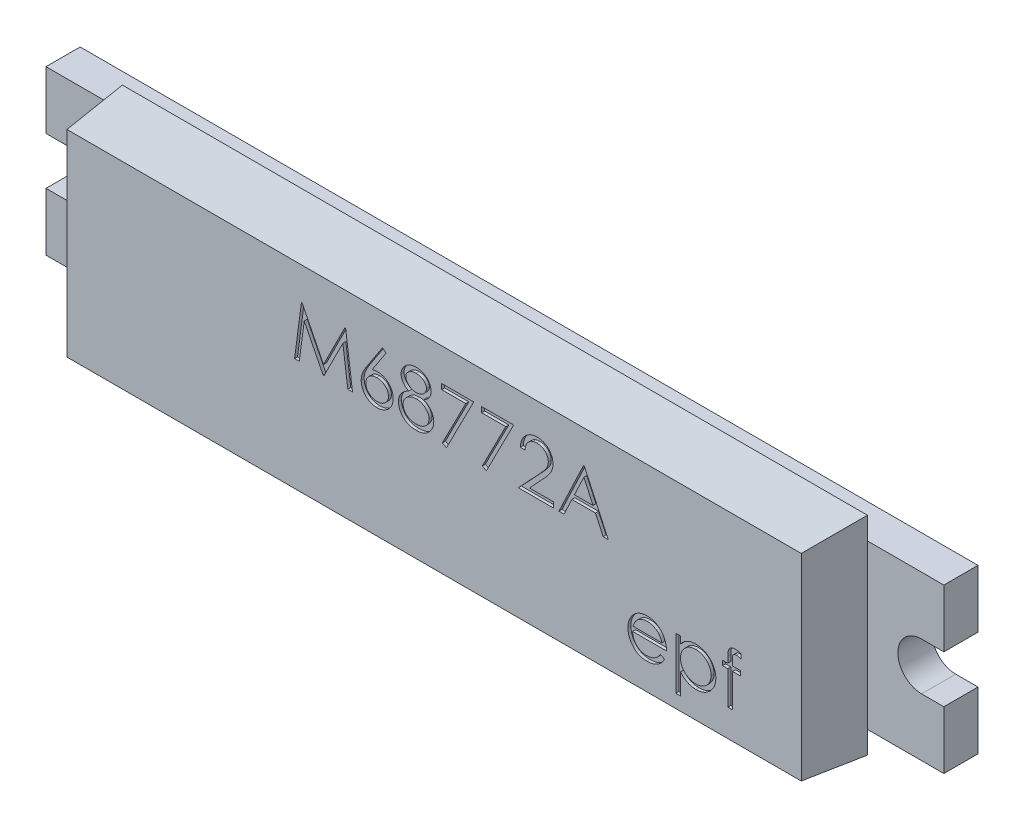
from build123d import *

# Parameters (mm, degrees)
CROQUIS1_W              = 60.5
CROQUIS1_H              = 11
SALIENTE_EXTRUIR1_DEPTH = 2.3
CORTAR_EXTRUIR1_REACH   = 32.832
CROQUIS3_W              = 50.2
CROQUIS3_H              = 14
SALIENTE_EXTRUIR2_DEPTH = 4.1
SALIENTE_EXTRUIR2_TAPER = 5
SALIENTE_EXTRUIR3_START = -8.3
SALIENTE_EXTRUIR3_DEPTH = 0.2
SALIENTE_EXTRUIR4_START = -21.3
SALIENTE_EXTRUIR4_DEPTH = 0.2
SALIENTE_EXTRUIR5_START = -43.3
SALIENTE_EXTRUIR5_DEPTH = 0.2
SALIENTE_EXTRUIR6_START = -51.3
SALIENTE_EXTRUIR6_DEPTH = 0.2
CORTAR_EXTRUIR2_DEPTH   = 0.2


with BuildPart() as part:
    # Croquis1 → Saliente-Extruir1 (new body)
    with BuildSketch(Plane.XY):
        Rectangle(CROQUIS1_W, CROQUIS1_H)
    extrude(amount=SALIENTE_EXTRUIR1_DEPTH)

    # Croquis2 → Cortar-Extruir1 (cut, up to next)
    with BuildSketch(Plane.XY.offset(2.3), mode=Mode.PRIVATE) as cortar_extruir1_sk1:
        with BuildLine():
            Line((-28.75, 1.6), (-31.56977125, 1.6))
            Line((-31.56977125, 1.6), (-31.56977125, -1.6))
            Line((-31.56977125, -1.6), (-28.75, -1.6))
            ThreePointArc((-28.75, -1.6), (-27.15, 0), (-28.75, 1.6))
        make_face()
    cortar_extruir1_tool1 = extrude(cortar_extruir1_sk1.sketch, amount=-CORTAR_EXTRUIR1_REACH, mode=Mode.PRIVATE) & part.part
    # Croquis2 → Cortar-Extruir1 (cut, up to next)
    with BuildSketch(Plane.XY.offset(2.3), mode=Mode.PRIVATE) as cortar_extruir1_sk2:
        with BuildLine():
            Line((28.75, 1.6), (32.357383151, 1.6))
            Line((32.357383151, 1.6), (32.357383151, -1.6))
            Line((32.357383151, -1.6), (28.75, -1.6))
            ThreePointArc((28.75, -1.6), (27.15, 0), (28.75, 1.6))
        make_face()
    cortar_extruir1_tool2 = extrude(cortar_extruir1_sk2.sketch, amount=-CORTAR_EXTRUIR1_REACH, mode=Mode.PRIVATE) & part.part
    add(cortar_extruir1_tool1.solids().sort_by_distance((-29.515925, 0, 2.3))[0], mode=Mode.SUBTRACT)
    add(cortar_extruir1_tool2.solids().sort_by_distance((29.912264, 0, 2.3))[0], mode=Mode.SUBTRACT)

    # Croquis3 → Saliente-Extruir2 (add)
    with BuildSketch(Plane.XY.offset(2.3)):
        Rectangle(CROQUIS3_W, CROQUIS3_H)
    extrude(amount=SALIENTE_EXTRUIR2_DEPTH, taper=SALIENTE_EXTRUIR2_TAPER)

    # Croquis6 → Saliente-Extruir3 (add)
    with BuildSketch(Plane.ZY.offset(30.25).offset(SALIENTE_EXTRUIR3_START)):
        with BuildLine():
            Line((0, -10), (0.2, -10))
            Line((0.2, -10), (0.2, -9.074823795))
            Line((0.2, -9.074823795), (3.528216632, -8.09593655))
            ThreePointArc((3.528216632, -8.09593655), (3.580067669, -8.059909669), (3.6, -8))
            Line((3.6, -8), (3.6, 0))
            Line((3.6, 0), (3.4, 0))
            Line((3.4, 0), (3.4, -7.925176205))
            Line((3.4, -7.925176205), (0.071783368, -8.90406345))
            ThreePointArc((0.071783368, -8.90406345), (0.019932331, -8.940090331), (0, -9))
            Line((0, -9), (0, -10))
        make_face()
    extrude(amount=SALIENTE_EXTRUIR3_DEPTH)

    # Croquis7 → Saliente-Extruir4 (add)
    with BuildSketch(Plane.ZY.offset(30.25).offset(SALIENTE_EXTRUIR4_START)):
        with BuildLine():
            Line((3.6, -6.886264737), (3.4, -6.90376247))
            Line((3.4, -6.90376247), (3.4, -7.925176205))
            Line((3.4, -7.925176205), (0.071783368, -8.90406345))
            ThreePointArc((0.071783368, -8.90406345), (0.019932331, -8.940090331), (0, -9))
            Line((0, -9), (0, -10))
            Line((0, -10), (0.2, -10))
            Line((0.2, -10), (0.2, -9.074823795))
            Line((0.2, -9.074823795), (3.528216632, -8.09593655))
            ThreePointArc((3.528216632, -8.09593655), (3.580067669, -8.059909669), (3.6, -8))
            Line((3.6, -8), (3.6, -6.886264737))
        make_face()
    extrude(amount=SALIENTE_EXTRUIR4_DEPTH)

    # Croquis8 → Saliente-Extruir5 (add)
    with BuildSketch(Plane.ZY.offset(30.25).offset(SALIENTE_EXTRUIR5_START)):
        with BuildLine():
            Line((3.6, -6.886264737), (3.4, -6.90376247))
            Line((3.4, -6.90376247), (3.4, -7.925176205))
            Line((3.4, -7.925176205), (0.071783368, -8.90406345))
            ThreePointArc((0.071783368, -8.90406345), (0.019932331, -8.940090331), (0, -9))
            Line((0, -9), (0, -10))
            Line((0, -10), (0.2, -10))
            Line((0.2, -10), (0.2, -9.074823795))
            Line((0.2, -9.074823795), (3.528216632, -8.09593655))
            ThreePointArc((3.528216632, -8.09593655), (3.580067669, -8.059909669), (3.6, -8))
            Line((3.6, -8), (3.6, -6.886264737))
        make_face()
    extrude(amount=SALIENTE_EXTRUIR5_DEPTH)

    # Croquis10 → Cortar-Extruir2 (cut)
    # profile 1 of 10: a face of its own
    with BuildSketch(Plane.XY.offset(6.4)):
        Polygon((-9.400373878, 0.94396844), (-8.938334615, 4.44396844), (-8.89346282, 4.44396844), (-7.448450801, 1.572173569), (-6.00694439, 4.44396844), (-5.961371474, 4.44396844), (-5.496527724, 0.94396844), (-5.812032531, 0.94396844), (-6.147168749, 3.462397928), (-7.410590224, 0.94396844), (-7.481403525, 0.94396844), (-8.749732852, 3.468006902), (-9.084167948, 0.94396844), align=None)
    # profile 2 of 10: a face of its own
    with BuildSketch(Plane.XY.offset(6.4)):
        with BuildLine():
            Line((-3.477296955, 4.53371203), (-3.235409935, 4.343708024))
            Line((-3.235409935, 4.343708024), (-4.160189583, 2.929545364))
            add(Edge.make_bspline(
                [(-4.160189583, 2.929545364), (-4.098619306, 2.939359224), (-3.978519519, 2.958502269), (-3.85695362, 2.961660214), (-3.797709615, 2.96319921)],
                knots=[0, 0, 0, 0, 1.025318673, 2, 2, 2, 2], degree=3))
            add(Edge.make_bspline(
                [(-3.797709615, 2.96319921), (-3.762137118, 2.962243098), (-3.692113718, 2.960361021), (-3.589306916, 2.94587717), (-3.49051798, 2.923052058), (-3.396156368, 2.889779802), (-3.305883386, 2.847277448), (-3.21918099, 2.796338577), (-3.137678979, 2.734332897), (-3.0603278, 2.665067941), (-2.990100703, 2.588350957), (-2.927924647, 2.50694962), (-2.875697856, 2.420948739), (-2.833323934, 2.330391873), (-2.800419055, 2.235418614), (-2.77643141, 2.136150474), (-2.762251818, 2.032519003), (-2.760326327, 1.962040827), (-2.759348237, 1.926240075)],
                knots=[0, 0, 0, 0, 1.04369286, 2.054478336, 3.041073146, 4.015093852, 4.984733326, 5.965804835, 6.960378782, 7.985147595, 9.009457201, 10.008161701, 10.986880575, 11.956520048, 12.937015923, 13.931873656, 14.949455224, 16, 16, 16, 16], degree=3))
            add(Edge.make_bspline(
                [(-2.759348237, 1.926240075), (-2.760771341, 1.877260371), (-2.763571675, 1.780879905), (-2.791475471, 1.640503199), (-2.834835116, 1.506770683), (-2.896812644, 1.381817512), (-2.973795027, 1.265814942), (-3.06767262, 1.163029477), (-3.175116108, 1.07135944), (-3.296602906, 0.99470282), (-3.427345871, 0.932099769), (-3.564697868, 0.887134527), (-3.707325014, 0.859451058), (-3.804129622, 0.855980455), (-3.853098237, 0.854224851)],
                knots=[0, 0, 0, 0, 1.031375318, 2.029502543, 3.004789286, 3.987476834, 4.960371455, 5.9300674, 6.912260825, 7.929083631, 8.949397511, 9.960523116, 10.96833055, 12, 12, 12, 12], degree=3))
            add(Edge.make_bspline(
                [(-3.853098237, 0.854224851), (-3.900194937, 0.855753056), (-3.993485255, 0.858780165), (-4.130718049, 0.885746102), (-4.262581067, 0.929453205), (-4.388150448, 0.989667484), (-4.504471061, 1.065725367), (-4.608536697, 1.157287646), (-4.699828472, 1.262397111), (-4.775803093, 1.381037458), (-4.836061825, 1.508527416), (-4.88125175, 1.641464572), (-4.907647993, 1.779364554), (-4.91133655, 1.872845693), (-4.91319439, 1.919929979)],
                knots=[0, 0, 0, 0, 1.012016664, 2.004627821, 2.994792927, 3.992885782, 4.990978636, 5.973936114, 6.964471063, 7.975201453, 8.993600317, 9.990122807, 10.98767138, 12, 12, 12, 12], degree=3))
            add(Edge.make_bspline(
                [(-4.91319439, 1.919929979), (-4.912012945, 1.955974562), (-4.90960066, 2.029570714), (-4.89275727, 2.141034742), (-4.865692475, 2.255085824), (-4.835382229, 2.351840017), (-4.803356619, 2.431101539), (-4.776704079, 2.49500503), (-4.743530083, 2.560766103), (-4.708156702, 2.630639739), (-4.667399833, 2.702825172), (-4.623084184, 2.778528841), (-4.573984533, 2.856546769), (-4.53956437, 2.909490964), (-4.521968429, 2.936556582)],
                knots=[0, 0, 0, 0, 1.173818275, 2.396712641, 3.66331629, 4.989737886, 5.693666774, 6.447286557, 7.243889047, 8.091586357, 8.998013824, 9.943181721, 10.948533338, 12, 12, 12, 12], degree=3))
            Line((-4.521968429, 2.936556582), (-3.477296955, 4.53371203))
        make_face()
        with BuildLine():
            add(Edge.make_bspline(
                [(-3.863615063, 2.604224851), (-3.890277308, 2.603446807), (-3.942356418, 2.601927062), (-4.018763832, 2.59310181), (-4.091077084, 2.576482744), (-4.160254218, 2.555316412), (-4.22500192, 2.526213353), (-4.28579076, 2.490861554), (-4.342855812, 2.449240375), (-4.395599364, 2.401939464), (-4.443419027, 2.350151431), (-4.484600158, 2.294681909), (-4.520122558, 2.236867706), (-4.549004377, 2.176225764), (-4.571494453, 2.112779264), (-4.587762704, 2.046820015), (-4.596816455, 1.977905709), (-4.598322686, 1.931173206), (-4.599091826, 1.907309787)],
                knots=[0, 0, 0, 0, 1.129588631, 2.206414736, 3.251139165, 4.268635594, 5.265702196, 6.250456724, 7.242448911, 8.251968645, 9.246821453, 10.222880186, 11.173611482, 12.116736599, 13.062300278, 14.020270554, 14.989073742, 16, 16, 16, 16], degree=3))
            add(Edge.make_bspline(
                [(-4.599091826, 1.907309787), (-4.598465465, 1.883659807), (-4.597237263, 1.837285717), (-4.586084943, 1.768946537), (-4.569049861, 1.703181629), (-4.543709465, 1.64033003), (-4.513482577, 1.579433712), (-4.473577253, 1.522698427), (-4.429360467, 1.466678357), (-4.376506534, 1.415676885), (-4.319783171, 1.368220261), (-4.259181968, 1.326740008), (-4.196022008, 1.291253834), (-4.129450586, 1.263442737), (-4.060412202, 1.24061845), (-3.988331648, 1.22455697), (-3.913158793, 1.215476444), (-3.862236855, 1.213968251), (-3.836271313, 1.21319921)],
                knots=[0, 0, 0, 0, 0.989467248, 1.94019797, 2.891935182, 3.827694429, 4.772920941, 5.730924762, 6.725747692, 7.756678648, 8.79901574, 9.819492441, 10.826891316, 11.826466727, 12.835195252, 13.867842842, 14.912794438, 16, 16, 16, 16], degree=3))
            add(Edge.make_bspline(
                [(-3.836271313, 1.21319921), (-3.810305815, 1.213968311), (-3.75938396, 1.215476623), (-3.6842105, 1.224556292), (-3.612132182, 1.24062094), (-3.543085673, 1.26343371), (-3.476544242, 1.29128732), (-3.41343952, 1.326519239), (-3.353411427, 1.368475357), (-3.296650827, 1.415595785), (-3.244016889, 1.466968637), (-3.19873961, 1.52219836), (-3.160056377, 1.579892255), (-3.12862219, 1.640090145), (-3.103560898, 1.703219633), (-3.086439431, 1.768936356), (-3.075310142, 1.837288382), (-3.074078776, 1.883660707), (-3.073450801, 1.907309787)],
                knots=[0, 0, 0, 0, 1.087397944, 2.132534446, 3.165364764, 4.174271784, 5.174024072, 6.181601208, 7.194203697, 8.236725232, 9.267838612, 10.269026844, 11.221737037, 12.171628256, 13.107553087, 14.05945871, 15.010357665, 16, 16, 16, 16], degree=3))
            add(Edge.make_bspline(
                [(-3.073450801, 1.907309787), (-3.074001094, 1.931204338), (-3.07508114, 1.97810157), (-3.087297088, 2.046789188), (-3.104239462, 2.113114395), (-3.129822493, 2.176660344), (-3.163059038, 2.237176271), (-3.203542445, 2.294967872), (-3.250375015, 2.350478219), (-3.304472555, 2.402041027), (-3.363362789, 2.449188105), (-3.425978374, 2.490807662), (-3.491486348, 2.525932638), (-3.55982029, 2.555239741), (-3.631763173, 2.576389215), (-3.706153512, 2.593042458), (-3.783942755, 2.601904476), (-3.836719363, 2.603441541), (-3.863615063, 2.604224851)],
                knots=[0, 0, 0, 0, 0.978206639, 1.919901502, 2.851605144, 3.780102724, 4.718870031, 5.675451981, 6.667674623, 7.690630536, 8.733308323, 9.756129687, 10.767539656, 11.776269907, 12.797430371, 13.836405707, 14.897401972, 16, 16, 16, 16], degree=3))
        make_face(mode=Mode.SUBTRACT)
    # profile 3 of 10: a face of its own
    with BuildSketch(Plane.XY.offset(6.4)):
        with BuildLine():
            add(Edge.make_bspline(
                [(-0.698751281, 2.893788152), (-0.670102734, 2.878850196), (-0.6142285, 2.849716193), (-0.534651291, 2.802805365), (-0.46192629, 2.753364401), (-0.394035728, 2.703728541), (-0.332172378, 2.65199689), (-0.277027965, 2.597963734), (-0.227240345, 2.542977788), (-0.183813561, 2.486107948), (-0.145616724, 2.427505299), (-0.112604589, 2.367016026), (-0.084387386, 2.304772692), (-0.062024447, 2.240095862), (-0.043602656, 2.173935601), (-0.030927051, 2.105437619), (-0.024110133, 2.035053278), (-0.022821319, 1.987484976), (-0.022168749, 1.96339953)],
                knots=[0, 0, 0, 0, 1.272397273, 2.481599622, 3.635517121, 4.734568067, 5.792894095, 6.808321871, 7.773003508, 8.711915296, 9.623354172, 10.525449501, 11.423591555, 12.311487226, 13.218079475, 14.126165749, 15.051214107, 16, 16, 16, 16], degree=3))
            add(Edge.make_bspline(
                [(-0.022168749, 1.96339953), (-0.02294017, 1.929701798), (-0.024467101, 1.863001341), (-0.037767085, 1.764555229), (-0.057680063, 1.668943447), (-0.086759575, 1.576186957), (-0.124472966, 1.486797583), (-0.170949802, 1.40069881), (-0.223561007, 1.316479501), (-0.265813247, 1.264660099), (-0.287192788, 1.238439594)],
                knots=[0, 0, 0, 0, 1.025265484, 2.029385089, 3.018602448, 3.995076438, 4.983346944, 5.966715145, 6.97116228, 8, 8, 8, 8], degree=3))
            add(Edge.make_bspline(
                [(-0.287192788, 1.238439594), (-0.315029262, 1.20784582), (-0.370358228, 1.147036328), (-0.465141155, 1.068085518), (-0.569163039, 1.001736123), (-0.682021372, 0.947664229), (-0.803414473, 0.90557837), (-0.933316478, 0.875335852), (-1.071980631, 0.858013423), (-1.167286102, 0.855509433), (-1.216179166, 0.854224851)],
                knots=[0, 0, 0, 0, 0.954267603, 1.896743057, 2.838368354, 3.796610408, 4.779680527, 5.799409237, 6.871065594, 8, 8, 8, 8], degree=3))
            add(Edge.make_bspline(
                [(-1.216179166, 0.854224851), (-1.263192555, 0.855377329), (-1.354675834, 0.857619934), (-1.487833711, 0.872814365), (-1.611956781, 0.899442232), (-1.727766749, 0.935886841), (-1.834565443, 0.98329707), (-1.932048544, 1.042305478), (-2.021622516, 1.110536921), (-2.10056899, 1.189950999), (-2.170657434, 1.275008871), (-2.232225487, 1.362760481), (-2.283399565, 1.453213838), (-2.32672666, 1.545020206), (-2.359894683, 1.63946636), (-2.382866893, 1.736066373), (-2.397456208, 1.834651516), (-2.399397342, 1.901183169), (-2.400373878, 1.934653537)],
                knots=[0, 0, 0, 0, 1.256902934, 2.445805442, 3.576955095, 4.645999104, 5.686449165, 6.692658513, 7.68621702, 8.689161843, 9.678783111, 10.630372946, 11.551080876, 12.453998257, 13.34127905, 14.221779781, 15.105423033, 16, 16, 16, 16], degree=3))
            add(Edge.make_bspline(
                [(-2.400373878, 1.934653537), (-2.399795997, 1.959212729), (-2.3986539, 2.007750361), (-2.390749051, 2.079459689), (-2.37804059, 2.149255824), (-2.360781133, 2.217396567), (-2.337390107, 2.28338584), (-2.309147974, 2.347536314), (-2.276216021, 2.409920412), (-2.238134856, 2.470879294), (-2.193832832, 2.529558806), (-2.143669182, 2.5869548), (-2.086641314, 2.642176667), (-2.023383655, 2.695899092), (-1.954619115, 2.749075066), (-1.878561585, 2.798830795), (-1.797227317, 2.84868876), (-1.739421912, 2.878497085), (-1.70976891, 2.893788152)],
                knots=[0, 0, 0, 0, 0.941657376, 1.861047343, 2.762797495, 3.66048619, 4.553285746, 5.444104102, 6.34607688, 7.256116206, 8.197091036, 9.162375105, 10.176350973, 11.237807142, 12.343728897, 13.50695164, 14.721116704, 16, 16, 16, 16], degree=3))
            add(Edge.make_bspline(
                [(-1.70976891, 2.893788152), (-1.750360284, 2.915922921), (-1.828956547, 2.958782028), (-1.933025988, 3.037528834), (-2.022416612, 3.122816649), (-2.094671329, 3.216446444), (-2.151543557, 3.315493318), (-2.190562162, 3.419337571), (-2.216958646, 3.526053684), (-2.219573473, 3.598959881), (-2.220886698, 3.635575011)],
                knots=[0, 0, 0, 0, 1.166880483, 2.259407225, 3.286803203, 4.280235371, 5.237608625, 6.161067461, 7.076446754, 8, 8, 8, 8], degree=3))
            add(Edge.make_bspline(
                [(-2.220886698, 3.635575011), (-2.219251274, 3.672872569), (-2.215963786, 3.747847166), (-2.189380466, 3.85945329), (-2.146060399, 3.969069855), (-2.087139402, 4.076165567), (-2.013752186, 4.177115782), (-1.92570564, 4.267656728), (-1.825102343, 4.346968211), (-1.712444476, 4.413544384), (-1.591208241, 4.467728042), (-1.463292517, 4.505106465), (-1.330926024, 4.529542582), (-1.240828304, 4.532309237), (-1.195145512, 4.53371203)],
                knots=[0, 0, 0, 0, 0.888701115, 1.786444228, 2.72001202, 3.692817113, 4.693886446, 5.687152267, 6.695133018, 7.739871481, 8.800368666, 9.853104506, 10.91144658, 12, 12, 12, 12], degree=3))
            add(Edge.make_bspline(
                [(-1.195145512, 4.53371203), (-1.150641697, 4.532265687), (-1.062885244, 4.529413663), (-0.933890616, 4.505626785), (-0.810465739, 4.465897265), (-0.69303624, 4.412000042), (-0.583704373, 4.345613101), (-0.487102063, 4.265212227), (-0.401769481, 4.175070677), (-0.331185087, 4.074151073), (-0.273022198, 3.96746688), (-0.232521297, 3.855844359), (-0.206569323, 3.7416953), (-0.203295958, 3.664457296), (-0.201655929, 3.625759306)],
                knots=[0, 0, 0, 0, 1.072916533, 2.115669174, 3.151510826, 4.193348718, 5.225979165, 6.227137561, 7.216255879, 8.211077061, 9.189680878, 10.138522389, 11.067357538, 12, 12, 12, 12], degree=3))
            add(Edge.make_bspline(
                [(-0.201655929, 3.625759306), (-0.20309049, 3.587782642), (-0.205907885, 3.513198633), (-0.229607825, 3.404472112), (-0.269521138, 3.302650073), (-0.324015301, 3.206577121), (-0.395040789, 3.117995623), (-0.481649522, 3.035779154), (-0.583151, 2.959252325), (-0.659411886, 2.916065961), (-0.698751281, 2.893788152)],
                knots=[0, 0, 0, 0, 0.975232327, 1.915300861, 2.843280834, 3.77672583, 4.742871857, 5.749627742, 6.839139064, 8, 8, 8, 8], degree=3))
        make_face()
        with BuildLine():
            add(Edge.make_bspline(
                [(-1.212673557, 4.174737671), (-1.237224363, 4.174086231), (-1.285256474, 4.172811728), (-1.355685145, 4.166153091), (-1.422657513, 4.153199874), (-1.486873313, 4.135961163), (-1.547452125, 4.112673175), (-1.60521668, 4.085278165), (-1.65918387, 4.0519721), (-1.710005173, 4.014610902), (-1.755755947, 3.973517996), (-1.796360499, 3.930704277), (-1.830088613, 3.885328885), (-1.858729723, 3.838520525), (-1.87951124, 3.788889949), (-1.895075544, 3.737958773), (-1.905596935, 3.685083389), (-1.906385325, 3.648946878), (-1.906784134, 3.630667158)],
                knots=[0, 0, 0, 0, 1.203892937, 2.355340988, 3.463153438, 4.544400666, 5.610487187, 6.640501085, 7.674077295, 8.714426146, 9.728707835, 10.68524104, 11.601827946, 12.495867327, 13.368432065, 14.231010473, 15.105153427, 16, 16, 16, 16], degree=3))
            add(Edge.make_bspline(
                [(-1.906784134, 3.630667158), (-1.906096767, 3.612386649), (-1.904738431, 3.576261736), (-1.894233303, 3.52291587), (-1.878576449, 3.470494233), (-1.853925787, 3.420243322), (-1.824359429, 3.370419963), (-1.787867953, 3.322269377), (-1.744378925, 3.275623992), (-1.695351485, 3.230880551), (-1.641939947, 3.188981788), (-1.585355903, 3.152608606), (-1.526309512, 3.122174496), (-1.465407443, 3.096845091), (-1.402028995, 3.077155154), (-1.336562522, 3.063186507), (-1.26899702, 3.05450451), (-1.223216439, 3.053467489), (-1.200053365, 3.052942799)],
                knots=[0, 0, 0, 0, 0.873023192, 1.725219244, 2.590779336, 3.480155217, 4.391973325, 5.357036234, 6.360879153, 7.436073238, 8.526419356, 9.601555421, 10.645666583, 11.697338044, 12.750135903, 13.812665442, 14.89329948, 16, 16, 16, 16], degree=3))
            add(Edge.make_bspline(
                [(-1.200053365, 3.052942799), (-1.170303261, 3.053815667), (-1.111096893, 3.05555278), (-1.023817562, 3.071703953), (-0.938954917, 3.097109871), (-0.857416013, 3.131869837), (-0.781311428, 3.175497697), (-0.713471359, 3.227730715), (-0.654474467, 3.287362813), (-0.604933856, 3.353465648), (-0.56652401, 3.423817237), (-0.536622202, 3.494417529), (-0.519160987, 3.56601976), (-0.51688342, 3.613986724), (-0.515758493, 3.637678376)],
                knots=[0, 0, 0, 0, 1.076279235, 2.141928126, 3.20205304, 4.278698113, 5.344010996, 6.36967002, 7.368914609, 8.37248503, 9.349703398, 10.264243087, 11.142681841, 12, 12, 12, 12], degree=3))
            add(Edge.make_bspline(
                [(-0.515758493, 3.637678376), (-0.516290391, 3.654306412), (-0.517346131, 3.68731068), (-0.526046187, 3.736049046), (-0.54042202, 3.783678629), (-0.5598851, 3.8305929), (-0.585494895, 3.876133632), (-0.615859082, 3.92101672), (-0.652743584, 3.964232484), (-0.694140017, 4.006788032), (-0.741085426, 4.046172056), (-0.793489338, 4.080806766), (-0.851083088, 4.110219123), (-0.913868038, 4.134107877), (-0.981612962, 4.152050227), (-1.054005837, 4.165486575), (-1.131650284, 4.173059686), (-1.185080035, 4.174166212), (-1.212673557, 4.174737671)],
                knots=[0, 0, 0, 0, 0.814439003, 1.616544685, 2.417341072, 3.248991801, 4.09997495, 4.973547432, 5.9003056, 6.880240646, 7.880314356, 8.896779544, 9.951930927, 11.043077905, 12.18215768, 13.381699519, 14.647792085, 16, 16, 16, 16], degree=3))
        make_face(mode=Mode.SUBTRACT)
        with BuildLine():
            add(Edge.make_bspline(
                [(-1.192341025, 2.69396844), (-1.223466811, 2.693414799), (-1.284528007, 2.69232869), (-1.373984935, 2.680239189), (-1.459838101, 2.663409796), (-1.541798037, 2.637878958), (-1.619830134, 2.604682468), (-1.694356817, 2.564747928), (-1.764807946, 2.517542484), (-1.830210672, 2.463665869), (-1.889934002, 2.405606415), (-1.942332302, 2.34414428), (-1.986829822, 2.280421747), (-2.022663073, 2.213629518), (-2.052074805, 2.145181907), (-2.071388683, 2.073374312), (-2.083770394, 1.999587198), (-2.085433026, 1.9494271), (-2.086271313, 1.92413671)],
                knots=[0, 0, 0, 0, 1.140299081, 2.23698856, 3.303958914, 4.344563908, 5.37730929, 6.408454204, 7.439741482, 8.480804886, 9.510774543, 10.48932336, 11.43758569, 12.353841022, 13.263987381, 14.161954604, 15.073269652, 16, 16, 16, 16], degree=3))
            add(Edge.make_bspline(
                [(-2.086271313, 1.92413671), (-2.084908055, 1.892705804), (-2.082203381, 1.83034762), (-2.060746742, 1.738184549), (-2.026311207, 1.648963494), (-1.978285991, 1.563411541), (-1.918818418, 1.483461435), (-1.84569195, 1.413772659), (-1.763451113, 1.351851181), (-1.669313259, 1.301770647), (-1.566484793, 1.261775792), (-1.454993064, 1.23421983), (-1.336438145, 1.21597838), (-1.254578553, 1.214140199), (-1.212673557, 1.21319921)],
                knots=[0, 0, 0, 0, 0.898778495, 1.783155532, 2.693654817, 3.627872908, 4.583023416, 5.533784346, 6.509005473, 7.520592997, 8.575161974, 9.658835044, 10.801527049, 12, 12, 12, 12], degree=3))
            add(Edge.make_bspline(
                [(-1.212673557, 1.21319921), (-1.179923189, 1.213828018), (-1.11611497, 1.215053139), (-1.023029021, 1.225867433), (-0.935184473, 1.243017058), (-0.852751674, 1.267960603), (-0.774807834, 1.29841058), (-0.70267448, 1.337582661), (-0.634495953, 1.382134985), (-0.573631831, 1.434993141), (-0.518198622, 1.491472636), (-0.469865329, 1.551262679), (-0.427907778, 1.612738311), (-0.394976822, 1.677288796), (-0.368650569, 1.74367571), (-0.349727014, 1.812511222), (-0.338050799, 1.884006455), (-0.336869903, 1.932505526), (-0.336271313, 1.957089434)],
                knots=[0, 0, 0, 0, 1.224942928, 2.386581632, 3.501229538, 4.569074225, 5.605009692, 6.626002462, 7.634866581, 8.645888296, 9.63523824, 10.59253846, 11.518950513, 12.414518923, 13.29783783, 14.186679152, 15.080837789, 16, 16, 16, 16], degree=3))
            add(Edge.make_bspline(
                [(-0.336271313, 1.957089434), (-0.337177162, 1.980966775), (-0.338963337, 2.028048719), (-0.350300028, 2.097815246), (-0.370215906, 2.16521806), (-0.397543302, 2.231068066), (-0.433924265, 2.294031017), (-0.476769135, 2.355747188), (-0.528463254, 2.414503633), (-0.58687585, 2.470756729), (-0.650534811, 2.522772466), (-0.718201955, 2.568786904), (-0.789356418, 2.60753902), (-0.863847628, 2.639055516), (-0.941510184, 2.663842985), (-1.022286963, 2.681158981), (-1.106272538, 2.692058583), (-1.163327408, 2.693324629), (-1.192341025, 2.69396844)],
                knots=[0, 0, 0, 0, 0.917430815, 1.809013306, 2.70690318, 3.612392954, 4.541220862, 5.495268465, 6.494511384, 7.542276156, 8.608045339, 9.649016899, 10.681629292, 11.715607085, 12.752076957, 13.808767841, 14.885711793, 16, 16, 16, 16], degree=3))
        make_face(mode=Mode.SUBTRACT)
    # profile 4 of 10: a face of its own
    with BuildSketch(Plane.XY.offset(6.4)):
        Polygon((0.516292789, 4.44396844), (2.670138943, 4.44396844), (0.830395353, 0.854224851), (0.559061219, 1.003563793), (2.138688622, 4.084994082), (0.516292789, 4.084994082), align=None)
    # profile 5 of 10: a face of its own
    with BuildSketch(Plane.XY.offset(6.4)):
        Polygon((3.208600481, 4.44396844), (5.362446635, 4.44396844), (3.522703045, 0.854224851), (3.251368911, 1.003563793), (4.830996315, 4.084994082), (3.208600481, 4.084994082), align=None)
    # profile 6 of 10: a face of its own
    with BuildSketch(Plane.XY.offset(6.4)):
        with BuildLine():
            Line((6.125267148, 3.367045364), (5.811164584, 3.367045364))
            add(Edge.make_bspline(
                [(5.811164584, 3.367045364), (5.813211737, 3.408716251), (5.817232291, 3.490556766), (5.83606058, 3.609880672), (5.863001457, 3.723935471), (5.901092911, 3.831805385), (5.948399189, 3.934444192), (6.005129217, 4.031444208), (6.072323067, 4.122435397), (6.148529801, 4.20657424), (6.23129844, 4.283761811), (6.32060438, 4.350417054), (6.414449407, 4.406734725), (6.512548806, 4.453815967), (6.61600937, 4.489155813), (6.723892227, 4.515377452), (6.836671364, 4.531153798), (6.913511386, 4.532849584), (6.952590866, 4.53371203)],
                knots=[0, 0, 0, 0, 1.10065271, 2.161652631, 3.183658789, 4.190468796, 5.17591951, 6.163126047, 7.15150782, 8.156236427, 9.156009102, 10.134482811, 11.092018607, 12.041330605, 13.001268258, 13.972401359, 14.968799086, 16, 16, 16, 16], degree=3))
            add(Edge.make_bspline(
                [(6.952590866, 4.53371203), (6.99096894, 4.532813574), (7.066380485, 4.531048139), (7.176442499, 4.51588711), (7.281219794, 4.492141518), (7.38050756, 4.458826102), (7.473513625, 4.414041674), (7.560936669, 4.360244136), (7.64381748, 4.298024304), (7.718424264, 4.224770491), (7.786932343, 4.146568106), (7.846034598, 4.063080203), (7.896647762, 3.976850917), (7.938835441, 3.887222716), (7.96989158, 3.793351687), (7.993469788, 3.696604484), (8.006797202, 3.595979673), (8.008842626, 3.527873118), (8.009882533, 3.493247287)],
                knots=[0, 0, 0, 0, 1.111607364, 2.184268762, 3.212621178, 4.221274766, 5.211760367, 6.196651075, 7.1921475, 8.207485113, 9.220403448, 10.201281604, 11.166441695, 12.114753415, 13.065576456, 14.026450734, 14.996634279, 16, 16, 16, 16], degree=3))
            add(Edge.make_bspline(
                [(8.009882533, 3.493247287), (8.00818927, 3.444499452), (8.004832458, 3.347859238), (7.976118082, 3.205844376), (7.931271571, 3.068250957), (7.877274214, 2.957513654), (7.82280177, 2.868280161), (7.773714262, 2.794811456), (7.716249451, 2.715705987), (7.649570953, 2.63122865), (7.575058081, 2.540717745), (7.492035918, 2.44422795), (7.399912436, 2.34275618), (7.335253935, 2.273450578), (7.30174952, 2.237538152)],
                knots=[0, 0, 0, 0, 1.184426356, 2.348067706, 3.509069118, 4.696110526, 5.333549288, 6.050745305, 6.844228056, 7.710549037, 8.667450064, 9.695053472, 10.805634456, 12, 12, 12, 12], degree=3))
            Line((7.30174952, 2.237538152), (6.426048398, 1.302942799))
            Line((6.426048398, 1.302942799), (8.054754328, 1.302942799))
            Line((8.054754328, 1.302942799), (8.054754328, 0.94396844))
            Line((8.054754328, 0.94396844), (5.676549199, 0.94396844))
            Line((5.676549199, 0.94396844), (7.033920994, 2.392486069))
            add(Edge.make_bspline(
                [(7.033920994, 2.392486069), (7.066968881, 2.426984375), (7.130447108, 2.493248562), (7.220229685, 2.589991522), (7.300868673, 2.679741063), (7.372886066, 2.762327611), (7.434719571, 2.838959179), (7.489591803, 2.907153883), (7.533557394, 2.969908333), (7.58127279, 3.042648947), (7.627486771, 3.131461264), (7.667199127, 3.239994953), (7.691413976, 3.351722206), (7.694318811, 3.427224243), (7.695779969, 3.465202415)],
                knots=[0, 0, 0, 0, 1.329631726, 2.553950428, 3.673215718, 4.687767853, 5.603093632, 6.413772471, 7.123043292, 7.734684054, 8.834405432, 9.900288307, 10.943827018, 12, 12, 12, 12], degree=3))
            add(Edge.make_bspline(
                [(7.695779969, 3.465202415), (7.695144226, 3.489083813), (7.6938913, 3.536149464), (7.682833603, 3.605155223), (7.666123097, 3.671720036), (7.642177839, 3.736048656), (7.610571099, 3.797494308), (7.572097719, 3.856131788), (7.527707655, 3.912820753), (7.476356386, 3.965974051), (7.419944866, 4.014655257), (7.360350616, 4.057779342), (7.297300512, 4.093818453), (7.23106039, 4.12336195), (7.161814921, 4.146537331), (7.089430176, 4.162595911), (7.014106159, 4.172678395), (6.962672664, 4.174042566), (6.936465065, 4.174737671)],
                knots=[0, 0, 0, 0, 0.991446411, 1.95395049, 2.89581595, 3.838931463, 4.798493298, 5.75982156, 6.748411868, 7.785213223, 8.824556874, 9.840280684, 10.836137867, 11.835679398, 12.848801643, 13.863922112, 14.911575587, 16, 16, 16, 16], degree=3))
            add(Edge.make_bspline(
                [(6.936465065, 4.174737671), (6.909094232, 4.174022639), (6.855342436, 4.172618434), (6.776423403, 4.16279577), (6.701137625, 4.145849929), (6.629295722, 4.122673255), (6.560776137, 4.093214706), (6.495912092, 4.056522961), (6.434849203, 4.012739468), (6.37747268, 3.963098912), (6.324608701, 3.907831311), (6.278161825, 3.846221348), (6.237577811, 3.779393932), (6.202168577, 3.707529382), (6.173412887, 3.629975602), (6.151439737, 3.547007897), (6.13405289, 3.458986515), (6.128244369, 3.398201431), (6.125267148, 3.367045364)],
                knots=[0, 0, 0, 0, 1.031018746, 2.02475058, 2.990194455, 3.934040569, 4.864654155, 5.795059489, 6.735614925, 7.690564532, 8.649604399, 9.611025574, 10.590972636, 11.591080095, 12.624614302, 13.701020113, 14.821632451, 16, 16, 16, 16], degree=3))
        make_face()
    # profile 7 of 10: a face of its own
    with BuildSketch(Plane.XY.offset(6.4)):
        Polygon((10.118856892, 4.44396844), (11.734241507, 0.94396844), (11.392795193, 0.94396844), (10.875367308, 2.065763312), (9.288728687, 2.065763312), (8.756577244, 0.94396844), (8.413728687, 0.94396844), (10.073985097, 4.44396844), align=None)
        Polygon((10.092915385, 3.761776934), (9.459101283, 2.424737671), (10.709902565, 2.424737671), align=None, mode=Mode.SUBTRACT)
    # profile 8 of 10: a face of its own
    with BuildSketch(Plane.XY.offset(6.4)):
        with BuildLine():
            Line((15.249791511, -3.994243777), (15.528837986, -4.140778233))
            add(Edge.make_bspline(
                [(15.528837986, -4.140778233), (15.506601391, -4.180221564), (15.463337782, -4.256962667), (15.388937034, -4.362394527), (15.310944962, -4.457242243), (15.225840994, -4.538971897), (15.136171315, -4.610223282), (15.04143866, -4.672561107), (14.941149842, -4.725679627), (14.835300117, -4.770432155), (14.723000566, -4.804841649), (14.60397905, -4.82914587), (14.478007554, -4.844169139), (14.391661375, -4.84591428), (14.347447761, -4.84680788)],
                knots=[0, 0, 0, 0, 1.120438281, 2.179929193, 3.190490725, 4.156257408, 5.095198341, 6.022838206, 6.959905092, 7.901321166, 8.864066838, 9.862729781, 10.905609505, 12, 12, 12, 12], degree=3))
            add(Edge.make_bspline(
                [(14.347447761, -4.84680788), (14.298305784, -4.845660705), (14.202444022, -4.843422898), (14.062904275, -4.824130433), (13.931524857, -4.792658075), (13.808313153, -4.748692533), (13.693570901, -4.691265209), (13.587070046, -4.621305727), (13.48825052, -4.539173473), (13.400226311, -4.444157029), (13.320982428, -4.342475072), (13.251056608, -4.236519187), (13.192599177, -4.126555963), (13.145046567, -4.013285439), (13.106641702, -3.897421545), (13.079874998, -3.777910078), (13.06444525, -3.655074494), (13.062080805, -3.571977158), (13.060889268, -3.530101149)],
                knots=[0, 0, 0, 0, 1.145258523, 2.234067595, 3.276747158, 4.290159414, 5.277019952, 6.260822364, 7.254936242, 8.264827045, 9.274100331, 10.257902744, 11.220704747, 12.172965371, 13.118907548, 14.062713208, 15.023725156, 16, 16, 16, 16], degree=3))
            add(Edge.make_bspline(
                [(13.060889268, -3.530101149), (13.061948409, -3.490806319), (13.064047487, -3.412929154), (13.077278275, -3.29766361), (13.100726568, -3.185635157), (13.132902892, -3.076750709), (13.174454138, -2.971192575), (13.225286357, -2.868896511), (13.285478735, -2.769971372), (13.331951409, -2.707568238), (13.355360422, -2.676134803)],
                knots=[0, 0, 0, 0, 1.024358464, 2.0301432, 3.019427413, 4.004406732, 4.986367066, 5.972626655, 6.978780325, 8, 8, 8, 8], degree=3))
            add(Edge.make_bspline(
                [(13.355360422, -2.676134803), (13.387068105, -2.638265933), (13.449479051, -2.563727783), (13.555035406, -2.465789457), (13.669335603, -2.383745682), (13.790947229, -2.315738545), (13.921283703, -2.264064898), (14.058592994, -2.225557316), (14.20443858, -2.203979305), (14.304143801, -2.200931472), (14.355160101, -2.199371983)],
                knots=[0, 0, 0, 0, 1.030682036, 2.02871468, 2.997146059, 3.962720338, 4.930598197, 5.918074684, 6.934738563, 8, 8, 8, 8], degree=3))
            add(Edge.make_bspline(
                [(14.355160101, -2.199371983), (14.407607707, -2.200726031), (14.510497952, -2.203382367), (14.660530074, -2.2280087), (14.80249079, -2.267061255), (14.936323294, -2.322215045), (15.062041155, -2.393374597), (15.178827205, -2.481516438), (15.288678717, -2.583934526), (15.352587296, -2.662697735), (15.385108018, -2.702777431)],
                knots=[0, 0, 0, 0, 1.056321875, 2.072262726, 3.055038591, 4.01806755, 4.982017516, 5.957941055, 6.960871419, 8, 8, 8, 8], degree=3))
            add(Edge.make_bspline(
                [(15.385108018, -2.702777431), (15.407234956, -2.732981013), (15.451341549, -2.793187131), (15.506588649, -2.891358288), (15.554546044, -2.994068883), (15.592879005, -3.10297918), (15.623918507, -3.21679876), (15.646375325, -3.336341305), (15.659544944, -3.461571216), (15.662133641, -3.546897772), (15.66345337, -3.590397624)],
                knots=[0, 0, 0, 0, 0.94817472, 1.890038105, 2.849395472, 3.817997239, 4.812318967, 5.836947057, 6.897266129, 8, 8, 8, 8], degree=3))
            Line((15.66345337, -3.590397624), (13.374991832, -3.590397624))
            add(Edge.make_bspline(
                [(13.374991832, -3.590397624), (13.376531438, -3.624098088), (13.379559012, -3.690368692), (13.393674156, -3.787339475), (13.415922929, -3.879712817), (13.447191992, -3.966795859), (13.485058837, -4.049725986), (13.531444554, -4.127888023), (13.586784108, -4.200925953), (13.648509807, -4.269493091), (13.717216903, -4.330553852), (13.78949965, -4.385205628), (13.866393215, -4.431011225), (13.947291298, -4.468191115), (14.032063084, -4.497297431), (14.120735279, -4.517165252), (14.213133395, -4.530472358), (14.276119129, -4.531952024), (14.308184941, -4.532705316)],
                knots=[0, 0, 0, 0, 1.094153842, 2.151609401, 3.174256925, 4.172055639, 5.149267565, 6.128595816, 7.11444997, 8.118368179, 9.117203808, 10.09244225, 11.054858984, 12.015122123, 12.976791628, 13.957293641, 14.960065497, 16, 16, 16, 16], degree=3))
            add(Edge.make_bspline(
                [(14.308184941, -4.532705316), (14.339536089, -4.532097259), (14.40174278, -4.530890758), (14.494383637, -4.519158847), (14.585523164, -4.500188572), (14.674784148, -4.474298582), (14.760354993, -4.442721729), (14.839600543, -4.404618872), (14.912480759, -4.362469125), (14.980597726, -4.31425945), (15.046668719, -4.255251263), (15.112211205, -4.181615542), (15.182487859, -4.094528014), (15.226477452, -4.028982348), (15.249791511, -3.994243777)],
                knots=[0, 0, 0, 0, 0.99110716, 1.966546729, 2.947904876, 3.932708344, 4.903319531, 5.828989031, 6.710028674, 7.56322171, 8.463672341, 9.504779593, 10.677557249, 12, 12, 12, 12], degree=3))
        make_face()
        with BuildLine():
            add(Edge.make_bspline(
                [(15.349350806, -3.276295059), (15.337854182, -3.234632186), (15.31572688, -3.154444565), (15.269490516, -3.043403675), (15.217418975, -2.944715774), (15.155797244, -2.859136141), (15.085978518, -2.783132628), (15.005333336, -2.716714042), (14.914897442, -2.657296591), (14.815138301, -2.607144092), (14.709496516, -2.564454233), (14.598890324, -2.535829117), (14.486032536, -2.516219575), (14.40969825, -2.514393467), (14.371285903, -2.513474547)],
                knots=[0, 0, 0, 0, 1.154881502, 2.222775134, 3.210006277, 4.132804581, 5.035138423, 5.962687519, 6.919655026, 7.923214229, 8.944639381, 9.960483929, 10.97369054, 12, 12, 12, 12], degree=3))
            add(Edge.make_bspline(
                [(14.371285903, -2.513474547), (14.339936464, -2.514086218), (14.277965215, -2.515295364), (14.186664147, -2.526765494), (14.098984448, -2.545725338), (14.01427916, -2.571690295), (13.933658292, -2.606298898), (13.855463524, -2.646882124), (13.781683127, -2.696423708), (13.735541832, -2.734182563), (13.712231415, -2.7532582)],
                knots=[0, 0, 0, 0, 1.04873581, 2.073130211, 3.073294108, 4.04793562, 5.032784715, 6.005352987, 6.992311501, 8, 8, 8, 8], degree=3))
            add(Edge.make_bspline(
                [(13.712231415, -2.7532582), (13.695538133, -2.768352516), (13.661754999, -2.798899732), (13.616614478, -2.851528939), (13.573394005, -2.908280501), (13.534060352, -2.971325625), (13.497982766, -3.039946404), (13.464222789, -3.11356404), (13.433836376, -3.19273717), (13.416740266, -3.247909609), (13.407944556, -3.276295059)],
                knots=[0, 0, 0, 0, 0.879870761, 1.780643979, 2.707998968, 3.669668524, 4.684282772, 5.740141944, 6.837334558, 8, 8, 8, 8], degree=3))
            Line((13.407944556, -3.276295059), (15.349350806, -3.276295059))
        make_face(mode=Mode.SUBTRACT)
    # profile 9 of 10: a face of its own
    with BuildSketch(Plane.XY.offset(6.4)):
        with BuildLine():
            Line((16.291658499, -2.244243777), (16.605761063, -2.244243777))
            Line((16.605761063, -2.244243777), (16.605761063, -2.717500989))
            add(Edge.make_bspline(
                [(16.605761063, -2.717500989), (16.639118547, -2.674563255), (16.703942142, -2.591122362), (16.815667046, -2.483132234), (16.933593855, -2.39205693), (17.060757268, -2.320674397), (17.195180958, -2.266853585), (17.336313275, -2.227074135), (17.48535204, -2.203632661), (17.587248493, -2.200810999), (17.639214588, -2.199371983)],
                knots=[0, 0, 0, 0, 1.0828784, 2.104357462, 3.088488658, 4.04616522, 5.001424249, 5.969181776, 6.964304535, 8, 8, 8, 8], degree=3))
            add(Edge.make_bspline(
                [(17.639214588, -2.199371983), (17.684606192, -2.200685161), (17.77432508, -2.203280728), (17.906388309, -2.220853783), (18.033563692, -2.250971475), (18.155131746, -2.294372391), (18.272394812, -2.348027861), (18.383616911, -2.415744896), (18.490530467, -2.494151087), (18.590446656, -2.584383238), (18.682768024, -2.682011504), (18.762614205, -2.787033809), (18.831486109, -2.895996395), (18.887156406, -3.010588487), (18.930764753, -3.129907717), (18.961779431, -3.254436158), (18.980237074, -3.383712098), (18.982713526, -3.471614819), (18.983966191, -3.516078713)],
                knots=[0, 0, 0, 0, 1.041296284, 2.058176809, 3.050446431, 4.034000596, 5.01514041, 6.003636468, 7.015969324, 8.052561599, 9.08815499, 10.094063707, 11.074456064, 12.040834395, 13.011057502, 13.983766392, 14.980127149, 16, 16, 16, 16], degree=3))
            add(Edge.make_bspline(
                [(18.983966191, -3.516078713), (18.982740705, -3.561481022), (18.980323871, -3.651020926), (18.961578865, -3.782508024), (18.931621991, -3.908995397), (18.888563808, -4.030272661), (18.832922319, -4.146256312), (18.765217759, -4.256862708), (18.685331292, -4.362056411), (18.594030164, -4.460409312), (18.494977228, -4.551008624), (18.389099739, -4.630246694), (18.278040813, -4.696788069), (18.162368646, -4.752371029), (18.041093008, -4.794263213), (17.91477973, -4.824481014), (17.783497583, -4.843115509), (17.694196431, -4.845567652), (17.649030294, -4.84680788)],
                knots=[0, 0, 0, 0, 1.038740735, 2.04854663, 3.033179607, 4.009277356, 4.987731542, 5.972001279, 6.972200261, 8.005528982, 9.039189865, 10.040446548, 11.026516639, 11.997840187, 12.972163198, 13.956796175, 14.96660207, 16, 16, 16, 16], degree=3))
            add(Edge.make_bspline(
                [(17.649030294, -4.84680788), (17.598202722, -4.845513072), (17.497803366, -4.842955447), (17.351005695, -4.817036037), (17.209728843, -4.778299102), (17.075538018, -4.721600108), (16.947370206, -4.649344592), (16.8259504, -4.561234386), (16.710633647, -4.457453761), (16.64122489, -4.378721945), (16.605761063, -4.338494579)],
                knots=[0, 0, 0, 0, 1.014726462, 2.004382257, 2.969841629, 3.936926163, 4.907207904, 5.903978561, 6.929055279, 8, 8, 8, 8], degree=3))
            Line((16.605761063, -4.338494579), (16.605761063, -5.744243777))
            Line((16.605761063, -5.744243777), (16.291658499, -5.744243777))
            Line((16.291658499, -5.744243777), (16.291658499, -2.244243777))
        make_face()
        with BuildLine():
            add(Edge.make_bspline(
                [(17.636410101, -2.513474547), (17.600830539, -2.514114805), (17.530783551, -2.515375308), (17.428111332, -2.530349257), (17.329215904, -2.552086998), (17.235093953, -2.584998898), (17.144843336, -2.625397712), (17.059159172, -2.675879723), (16.978101604, -2.735531729), (16.901874574, -2.803211073), (16.83301128, -2.877785761), (16.772048352, -2.95737357), (16.720841047, -3.041873709), (16.678339027, -3.130499072), (16.645995744, -3.223944357), (16.623040024, -3.32167737), (16.608609672, -3.423805082), (16.606720734, -3.493361089), (16.605761063, -3.528698906)],
                knots=[0, 0, 0, 0, 1.05670511, 2.080379991, 3.077984906, 4.06214886, 5.038337365, 6.01289324, 7.01187578, 8.025460281, 9.038092164, 10.024533457, 11.000252242, 11.969694649, 12.940728589, 13.933144304, 14.949937299, 16, 16, 16, 16], degree=3))
            add(Edge.make_bspline(
                [(16.605761063, -3.528698906), (16.607351919, -3.575087018), (16.610468541, -3.665965259), (16.635805909, -3.798749381), (16.677041173, -3.924401037), (16.735569886, -4.041862074), (16.809517461, -4.149844909), (16.898615617, -4.246535515), (17.002058168, -4.331326106), (17.11812536, -4.40274736), (17.24254749, -4.460735426), (17.372333402, -4.502249637), (17.505698283, -4.527821865), (17.595866603, -4.531068684), (17.641317954, -4.532705316)],
                knots=[0, 0, 0, 0, 1.03728447, 2.032128127, 3.01272805, 3.987917167, 4.958271349, 5.931593992, 6.91984656, 7.941419022, 8.973179163, 9.983609215, 10.983593296, 12, 12, 12, 12], degree=3))
            add(Edge.make_bspline(
                [(17.641317954, -4.532705316), (17.685853722, -4.531148939), (17.774249215, -4.528059811), (17.904407336, -4.501321623), (18.030897975, -4.460476599), (18.151078147, -4.400917042), (18.263901635, -4.327926984), (18.365783188, -4.240366951), (18.454790102, -4.138877008), (18.530654457, -4.025868505), (18.591785942, -3.904693121), (18.637716182, -3.779311733), (18.664224756, -3.650166309), (18.667981544, -3.563168597), (18.669863627, -3.519584322)],
                knots=[0, 0, 0, 0, 1.00104056, 1.986885549, 2.97790532, 3.984399681, 4.995088187, 5.994304198, 6.996462723, 8.023150851, 9.048424203, 10.043036403, 11.019596776, 12, 12, 12, 12], degree=3))
            add(Edge.make_bspline(
                [(18.669863627, -3.519584322), (18.668408893, -3.475729333), (18.665510759, -3.388361029), (18.636963721, -3.259598126), (18.594063744, -3.13371015), (18.531504692, -3.014189601), (18.457303422, -2.901415518), (18.367556425, -2.801861639), (18.266940229, -2.714690966), (18.154251065, -2.642675556), (18.03331064, -2.585390061), (17.905995724, -2.543506423), (17.772952121, -2.518332673), (17.682324467, -2.515108167), (17.636410101, -2.513474547)],
                knots=[0, 0, 0, 0, 0.983928682, 1.960191568, 2.949917689, 3.96440592, 4.982380491, 5.975291189, 6.965713506, 7.964880129, 8.970154049, 9.96478489, 10.968906225, 12, 12, 12, 12], degree=3))
        make_face(mode=Mode.SUBTRACT)
    # profile 10 of 10: a face of its own
    with BuildSketch(Plane.XY.offset(6.4)):
        with BuildLine():
            Line((20.689094396, -1.233226149), (20.689094396, -1.559948906))
            add(Edge.make_bspline(
                [(20.689094396, -1.559948906), (20.659355617, -1.547998033), (20.602910796, -1.525315029), (20.51967042, -1.500650404), (20.443141586, -1.484714664), (20.393987696, -1.482478719), (20.370785101, -1.481423265)],
                knots=[0, 0, 0, 0, 1.16548392, 2.212112691, 3.15604595, 4, 4, 4, 4], degree=3))
            add(Edge.make_bspline(
                [(20.370785101, -1.481423265), (20.355111337, -1.482074605), (20.324772158, -1.483335382), (20.281168831, -1.489763658), (20.241879621, -1.502866459), (20.206974001, -1.519895735), (20.178023541, -1.541249919), (20.153237317, -1.562705183), (20.135270787, -1.586890363), (20.125515839, -1.609410774), (20.119565839, -1.630261767), (20.11777571, -1.651616033), (20.113390796, -1.677840119), (20.11216799, -1.710003837), (20.109380621, -1.747106548), (20.109627262, -1.789933444), (20.107343339, -1.837810587), (20.107685254, -1.871711136), (20.107864428, -1.889476149)],
                knots=[0, 0, 0, 0, 1.311993654, 2.539582093, 3.670788641, 4.763509788, 5.772417512, 6.671800701, 7.496729179, 8.266799162, 8.712543678, 9.304149002, 10.05334463, 10.934920737, 11.99209668, 13.165090968, 14.514413552, 16, 16, 16, 16], degree=3))
            Line((20.107864428, -1.889476149), (20.107864428, -2.244243777))
            Line((20.107864428, -2.244243777), (20.644222601, -2.244243777))
            Line((20.644222601, -2.244243777), (20.644222601, -2.558346342))
            Line((20.644222601, -2.558346342), (20.107163306, -2.558346342))
            Line((20.107163306, -2.558346342), (20.105761063, -4.801936085))
            Line((20.105761063, -4.801936085), (19.791658499, -4.801936085))
            Line((19.791658499, -4.801936085), (19.791658499, -2.558346342))
            Line((19.791658499, -2.558346342), (19.43268414, -2.558346342))
            Line((19.43268414, -2.558346342), (19.43268414, -2.244243777))
            Line((19.43268414, -2.244243777), (19.791658499, -2.244243777))
            Line((19.791658499, -2.244243777), (19.791658499, -1.835489771))
            add(Edge.make_bspline(
                [(19.791658499, -1.835489771), (19.791683713, -1.812814191), (19.791732085, -1.769313287), (19.795119935, -1.706703847), (19.798015656, -1.648880382), (19.803783284, -1.596291749), (19.81044499, -1.548445606), (19.819981149, -1.506052725), (19.82899252, -1.467970966), (19.845341112, -1.424868309), (19.869763331, -1.376018285), (19.909293528, -1.324394385), (19.956686535, -1.278089438), (20.013294859, -1.239082085), (20.077010394, -1.206666607), (20.147891572, -1.183424754), (20.22516677, -1.170284309), (20.27865424, -1.1683301), (20.306281896, -1.1673207)],
                knots=[0, 0, 0, 0, 1.116398763, 2.141702935, 3.087165306, 3.966655413, 4.746276475, 5.464069668, 6.106083417, 6.67047701, 7.730773247, 8.782666744, 9.856985883, 10.980834087, 12.154321827, 13.366232824, 14.639591414, 16, 16, 16, 16], degree=3))
            add(Edge.make_bspline(
                [(20.306281896, -1.1673207), (20.334358654, -1.168278081), (20.393304319, -1.170288051), (20.485500921, -1.182721458), (20.585097439, -1.204192488), (20.653433359, -1.223270373), (20.689094396, -1.233226149)],
                knots=[0, 0, 0, 0, 0.864728408, 1.815451418, 2.859995356, 4, 4, 4, 4], degree=3))
        make_face()
    extrude(amount=-CORTAR_EXTRUIR2_DEPTH, mode=Mode.SUBTRACT)


with BuildPart() as body_2:
    # Croquis9 → Saliente-Extruir6 (new body)
    with BuildSketch(Plane.ZY.offset(30.25).offset(SALIENTE_EXTRUIR6_START)):
        with BuildLine():
            Line((3.6, -6.886264737), (3.4, -6.90376247))
            Line((3.4, -6.90376247), (3.4, -7.925176205))
            Line((3.4, -7.925176205), (0.071783368, -8.90406345))
            ThreePointArc((0.071783368, -8.90406345), (0.019932331, -8.940090331), (0, -9))
            Line((0, -9), (0, -10))
            Line((0, -10), (0.2, -10))
            Line((0.2, -10), (0.2, -9.074823795))
            Line((0.2, -9.074823795), (3.528216632, -8.09593655))
            ThreePointArc((3.528216632, -8.09593655), (3.580067669, -8.059909669), (3.6, -8))
            Line((3.6, -8), (3.6, -6.886264737))
        make_face()
    extrude(amount=SALIENTE_EXTRUIR6_DEPTH)


solid = Compound([part.part, body_2.part])
